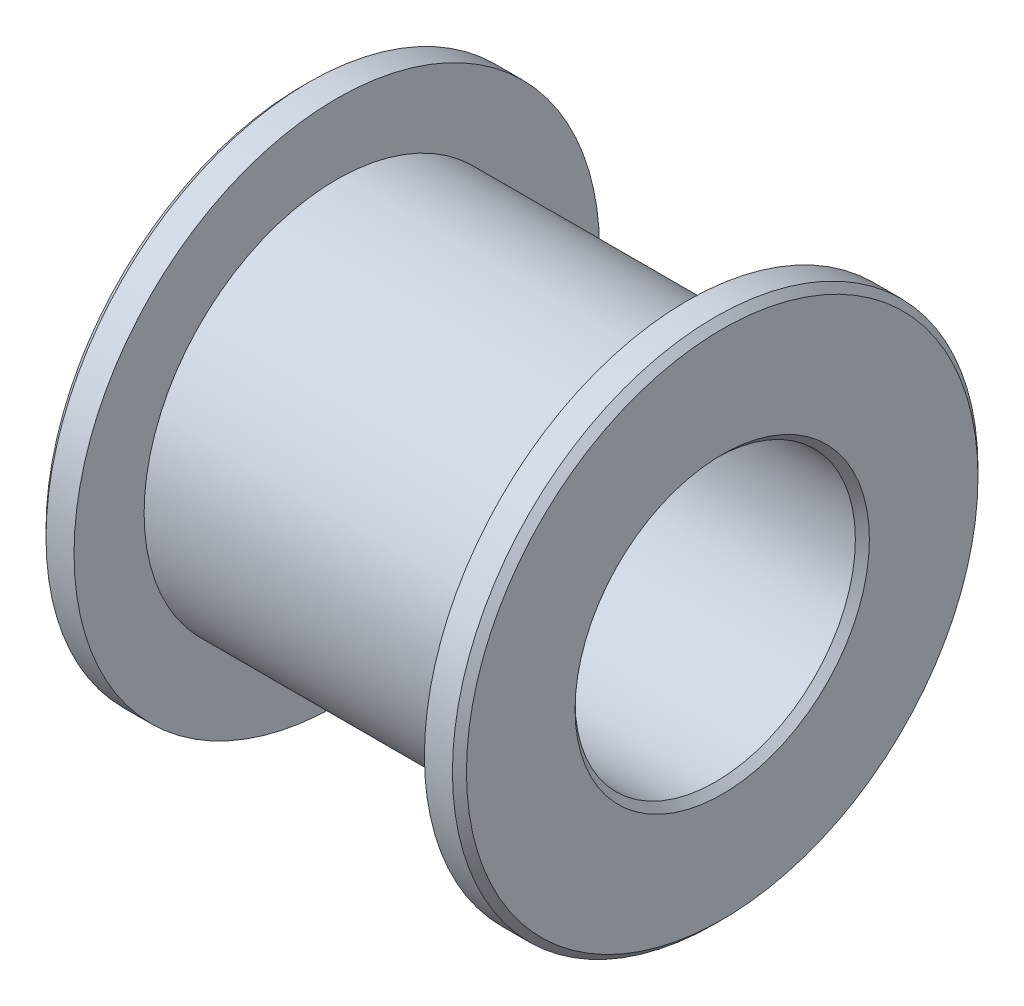
from build123d import *

# Parameters (mm, degrees)
CUT_EXTRUDE1_DEPTH      = 17.015617378
CUT_EXTRUDE1_DEPTH_BACK = 17.015617378
SKETCH2_R               = 4
CHAMFER1_SIZE           = 0.2
CUT_EXTRUDE2_DEPTH      = 5
CUT_EXTRUDE2_DEPTH_BACK = 5
SKETCH4_R               = 1.5


with BuildPart() as part:
    # Sketch1 → Revolve1 (revolve)
    with BuildSketch(Plane.XY):
        Polygon((0, 5.5), (-5, 5.5), (-5, 7.5), (-6, 7.5), (-6, 0), (0, 0), align=None)
    revolve1 = revolve(axis=Axis((-6, 0, 0), (1, 0, 0)))

    # Mirror1: Revolve1 across plane
    add(revolve1.mirror(Plane(origin=(0, 0, 0), x_dir=(0, 0, 1), z_dir=(1, 0, 0))))

    # Sketch2 → Cut-Extrude1 (cut, two sides: drawn at the far end of the back side and taken through both)
    with BuildSketch(Plane.ZY.offset(6).offset(-CUT_EXTRUDE1_DEPTH_BACK)):
        Circle(SKETCH2_R)
    extrude(amount=CUT_EXTRUDE1_DEPTH + CUT_EXTRUDE1_DEPTH_BACK, mode=Mode.SUBTRACT)

    # Chamfer1
    chamfer1_edges = [part.edges().sort_by_distance(p)[0] for p in [
        (6, 0, -4),
        (-6, 0, -4),
        (6, -7.5, 0),
        (-6, -7.5, 0),
    ]]
    chamfer(chamfer1_edges, length=CHAMFER1_SIZE)

    # Sketch4 → Cut-Extrude2 (cut, two sides: drawn at the far end of the back side and taken through both)
    with BuildSketch(Plane(origin=(0, -3.464101615, 2), x_dir=(-1, 0, 0), z_dir=(0, 0.866025403784438, -0.500000000000001)).offset(-CUT_EXTRUDE2_DEPTH_BACK)):
        Circle(SKETCH4_R)
    extrude(amount=CUT_EXTRUDE2_DEPTH + CUT_EXTRUDE2_DEPTH_BACK, mode=Mode.SUBTRACT)


solid = part.part
